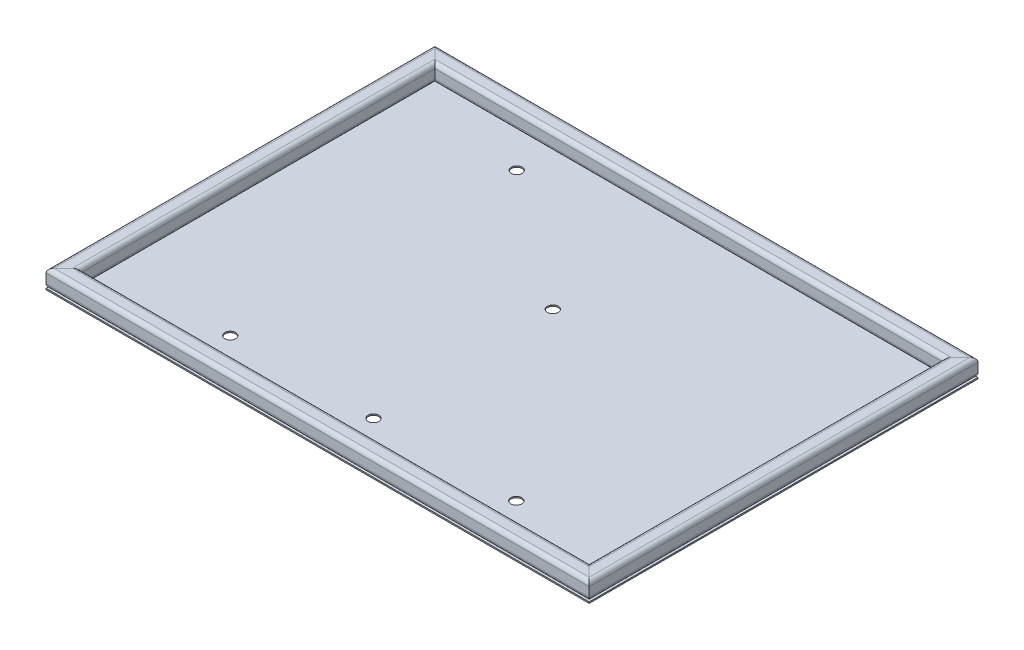
from build123d import *

# Parameters (mm, degrees)
TUBO_CUADRADO_2_X_2_X_0_25_1_DEPTH      = 606.921024484
TUBO_CUADRADO_2_X_2_X_0_25_1_DEPTH_BACK = 36.921024484
TUBO_CUADRADO_2_X_2_X_0_25_1_2_DEPTH    = 870.242048969
TUBO_CUADRADO_2_X_2_X_0_25_1_3_DEPTH    = 643.842048969
TUBO_CUADRADO_2_X_2_X_0_25_1_4_DEPTH    = 870.242048969
CROQUIS3_W                              = 796.4
CROQUIS3_H                              = 570
SALIENTE_EXTRUIR1_DEPTH                 = 1.9
CROQUIS4_R                              = 7.9375
CORTAR_EXTRUIR1_DEPTH                   = 10


with BuildPart() as part:
    # Sketch1 → Tubo cuadrado 2 X 2 X 0.25(1) (new, two sides: drawn at the far end of the back side and taken through both)
    with BuildSketch(Plane(origin=(-385.5, 12.7, -285), x_dir=(1, 0, 0), z_dir=(0, 0, 1)).offset(-TUBO_CUADRADO_2_X_2_X_0_25_1_DEPTH_BACK)):
        with BuildLine():
            Line((-6.7, -12.7), (6.7, -12.7))
            ThreePointArc((6.7, -12.7), (10.942640687, -10.942640687), (12.7, -6.7))
            Line((12.7, -6.7), (12.7, 6.7))
            ThreePointArc((12.7, 6.7), (10.942640687, 10.942640687), (6.7, 12.7))
            Line((6.7, 12.7), (-6.7, 12.7))
            ThreePointArc((-6.7, 12.7), (-10.942640687, 10.942640687), (-12.7, 6.7))
            Line((-12.7, 6.7), (-12.7, -6.7))
            ThreePointArc((-12.7, -6.7), (-10.942640687, -10.942640687), (-6.7, -12.7))
        make_face()
        with BuildLine():
            Line((-6.7, -9.7), (6.7, -9.7))
            ThreePointArc((6.7, -9.7), (8.821320344, -8.821320344), (9.7, -6.7))
            Line((9.7, -6.7), (9.7, 6.7))
            ThreePointArc((9.7, 6.7), (8.821320344, 8.821320344), (6.7, 9.7))
            Line((6.7, 9.7), (-6.7, 9.7))
            ThreePointArc((-6.7, 9.7), (-8.821320344, 8.821320344), (-9.7, 6.7))
            Line((-9.7, 6.7), (-9.7, -6.7))
            ThreePointArc((-9.7, -6.7), (-8.821320344, -8.821320344), (-6.7, -9.7))
        make_face(mode=Mode.SUBTRACT)
    extrude(amount=TUBO_CUADRADO_2_X_2_X_0_25_1_DEPTH + TUBO_CUADRADO_2_X_2_X_0_25_1_DEPTH_BACK)

    # Tubo cuadrado 2 X 2 X 0.25(1) mitre 1
    split(bisect_by=Plane(origin=(-398.2, 0, -285), x_dir=(0, -1, 0), z_dir=(-0.707106781, 0, 0.707106781)), keep=Keep.TOP)

    # Tubo cuadrado 2 X 2 X 0.25(1) mitre 2
    split(bisect_by=Plane(origin=(-398.2, 0, 285), x_dir=(0, -1, 0), z_dir=(-0.707106781, 0, -0.707106781)), keep=Keep.TOP)


with BuildPart() as body_2:
    # Sketch1 on segment 2 (carried to segment 2) → Tubo cuadrado 2 X 2 X 0.25_1 2 (new body)
    with BuildSketch(Plane(origin=(-435.121024484, 12.7, 272.3), x_dir=(0, 0, -1), z_dir=(1, 0, 0))):
        with BuildLine():
            Line((-6.7, -12.7), (6.7, -12.7))
            ThreePointArc((6.7, -12.7), (10.942640687, -10.942640687), (12.7, -6.7))
            Line((12.7, -6.7), (12.7, 6.7))
            ThreePointArc((12.7, 6.7), (10.942640687, 10.942640687), (6.7, 12.7))
            Line((6.7, 12.7), (-6.7, 12.7))
            ThreePointArc((-6.7, 12.7), (-10.942640687, 10.942640687), (-12.7, 6.7))
            Line((-12.7, 6.7), (-12.7, -6.7))
            ThreePointArc((-12.7, -6.7), (-10.942640687, -10.942640687), (-6.7, -12.7))
        make_face()
        with BuildLine():
            Line((-6.7, -9.7), (6.7, -9.7))
            ThreePointArc((6.7, -9.7), (8.821320344, -8.821320344), (9.7, -6.7))
            Line((9.7, -6.7), (9.7, 6.7))
            ThreePointArc((9.7, 6.7), (8.821320344, 8.821320344), (6.7, 9.7))
            Line((6.7, 9.7), (-6.7, 9.7))
            ThreePointArc((-6.7, 9.7), (-8.821320344, 8.821320344), (-9.7, 6.7))
            Line((-9.7, 6.7), (-9.7, -6.7))
            ThreePointArc((-9.7, -6.7), (-8.821320344, -8.821320344), (-6.7, -9.7))
        make_face(mode=Mode.SUBTRACT)
    extrude(amount=TUBO_CUADRADO_2_X_2_X_0_25_1_2_DEPTH)

    # Tubo cuadrado 2 X 2 X 0.25_1 2 mitre 1
    split(bisect_by=Plane(origin=(-398.2, 0, 285), x_dir=(0, 1, 0), z_dir=(0.707106781, 0, 0.707106781)), keep=Keep.TOP)

    # Tubo cuadrado 2 X 2 X 0.25_1 2 mitre 2
    split(bisect_by=Plane(origin=(398.2, 0, 285), x_dir=(0, -1, 0), z_dir=(-0.707106781, 0, 0.707106781)), keep=Keep.TOP)


with BuildPart() as body_3:
    # Sketch1 on segment 3 (carried to segment 3) → Tubo cuadrado 2 X 2 X 0.25_1 3 (new body)
    with BuildSketch(Plane(origin=(385.5, 12.7, 321.921024484), x_dir=(-1, 0, 0), z_dir=(0, 0, -1))):
        with BuildLine():
            Line((-6.7, -12.7), (6.7, -12.7))
            ThreePointArc((6.7, -12.7), (10.942640687, -10.942640687), (12.7, -6.7))
            Line((12.7, -6.7), (12.7, 6.7))
            ThreePointArc((12.7, 6.7), (10.942640687, 10.942640687), (6.7, 12.7))
            Line((6.7, 12.7), (-6.7, 12.7))
            ThreePointArc((-6.7, 12.7), (-10.942640687, 10.942640687), (-12.7, 6.7))
            Line((-12.7, 6.7), (-12.7, -6.7))
            ThreePointArc((-12.7, -6.7), (-10.942640687, -10.942640687), (-6.7, -12.7))
        make_face()
        with BuildLine():
            Line((-6.7, -9.7), (6.7, -9.7))
            ThreePointArc((6.7, -9.7), (8.821320344, -8.821320344), (9.7, -6.7))
            Line((9.7, -6.7), (9.7, 6.7))
            ThreePointArc((9.7, 6.7), (8.821320344, 8.821320344), (6.7, 9.7))
            Line((6.7, 9.7), (-6.7, 9.7))
            ThreePointArc((-6.7, 9.7), (-8.821320344, 8.821320344), (-9.7, 6.7))
            Line((-9.7, 6.7), (-9.7, -6.7))
            ThreePointArc((-9.7, -6.7), (-8.821320344, -8.821320344), (-6.7, -9.7))
        make_face(mode=Mode.SUBTRACT)
    extrude(amount=TUBO_CUADRADO_2_X_2_X_0_25_1_3_DEPTH)

    # Tubo cuadrado 2 X 2 X 0.25_1 3 mitre 1
    split(bisect_by=Plane(origin=(398.2, 0, -285), x_dir=(0, 1, 0), z_dir=(0.707106781, 0, 0.707106781)), keep=Keep.TOP)

    # Tubo cuadrado 2 X 2 X 0.25_1 3 mitre 2
    split(bisect_by=Plane(origin=(398.2, 0, 285), x_dir=(0, 1, 0), z_dir=(0.707106781, 0, -0.707106781)), keep=Keep.TOP)


with BuildPart() as body_4:
    # Sketch1 on segment 4 (carried to segment 4) → Tubo cuadrado 2 X 2 X 0.25_1 4 (new body)
    with BuildSketch(Plane(origin=(435.121024484, 12.7, -272.3), x_dir=(0, 0, 1), z_dir=(-1, 0, 0))):
        with BuildLine():
            Line((-6.7, -12.7), (6.7, -12.7))
            ThreePointArc((6.7, -12.7), (10.942640687, -10.942640687), (12.7, -6.7))
            Line((12.7, -6.7), (12.7, 6.7))
            ThreePointArc((12.7, 6.7), (10.942640687, 10.942640687), (6.7, 12.7))
            Line((6.7, 12.7), (-6.7, 12.7))
            ThreePointArc((-6.7, 12.7), (-10.942640687, 10.942640687), (-12.7, 6.7))
            Line((-12.7, 6.7), (-12.7, -6.7))
            ThreePointArc((-12.7, -6.7), (-10.942640687, -10.942640687), (-6.7, -12.7))
        make_face()
        with BuildLine():
            Line((-6.7, -9.7), (6.7, -9.7))
            ThreePointArc((6.7, -9.7), (8.821320344, -8.821320344), (9.7, -6.7))
            Line((9.7, -6.7), (9.7, 6.7))
            ThreePointArc((9.7, 6.7), (8.821320344, 8.821320344), (6.7, 9.7))
            Line((6.7, 9.7), (-6.7, 9.7))
            ThreePointArc((-6.7, 9.7), (-8.821320344, 8.821320344), (-9.7, 6.7))
            Line((-9.7, 6.7), (-9.7, -6.7))
            ThreePointArc((-9.7, -6.7), (-8.821320344, -8.821320344), (-6.7, -9.7))
        make_face(mode=Mode.SUBTRACT)
    extrude(amount=TUBO_CUADRADO_2_X_2_X_0_25_1_4_DEPTH)

    # Tubo cuadrado 2 X 2 X 0.25_1 4 mitre 1
    split(bisect_by=Plane(origin=(-398.2, 0, -285), x_dir=(0, 1, 0), z_dir=(0.707106781, 0, -0.707106781)), keep=Keep.TOP)

    # Tubo cuadrado 2 X 2 X 0.25_1 4 mitre 2
    split(bisect_by=Plane(origin=(398.2, 0, -285), x_dir=(0, -1, 0), z_dir=(-0.707106781, 0, -0.707106781)), keep=Keep.TOP)


with BuildPart() as body_5:
    # Croquis3 → Saliente-Extruir1 (new body)
    with BuildSketch(Plane.XZ):
        Rectangle(CROQUIS3_W, CROQUIS3_H)
    extrude(amount=SALIENTE_EXTRUIR1_DEPTH)

    # Croquis4 → Cortar-Extruir1 (cut)
    with BuildSketch(Plane(origin=(0, 0, 0), x_dir=(1, 0, 0), z_dir=(0, 1, 0))):
        with Locations(Location((216.35, -210, 0), (0, 0, 180))):
            Circle(CROQUIS4_R)
        with Locations(Location((6.95, -210, 0), (0, 0, 180))):
            Circle(CROQUIS4_R)
        with Locations(Location((-203.05, -210, 0), (0, 0, 180))):
            Circle(CROQUIS4_R)
        with Locations(Location((-203.05, 209.995, 0), (0, 0, 180))):
            Circle(CROQUIS4_R)
        with Locations(Location((0, 59.858030887, 0), (0, 0, 180))):
            Circle(CROQUIS4_R)
    extrude(amount=-CORTAR_EXTRUIR1_DEPTH, mode=Mode.SUBTRACT)


solid = Compound([part.part, body_2.part, body_3.part, body_4.part, body_5.part])
